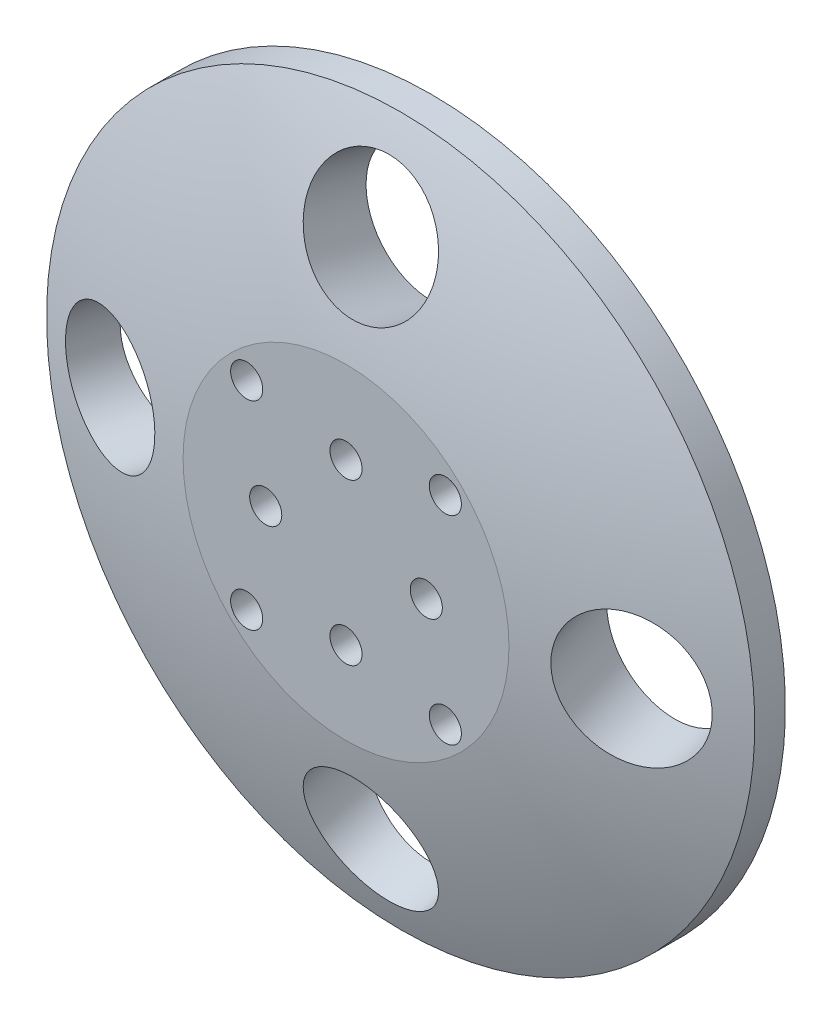
from build123d import *

# Parameters (mm, degrees)
PATTERN_CIRCULAR_1_COUNT = 4
SKETCH_3_R               = 1.6
CUT_EXTRUDE_1_DEPTH      = 10
MOVE_BODY_4_ANGLE        = 90


with BuildPart() as part:
    # 草图1 → 旋转1 (revolve)
    with BuildSketch(Plane(origin=(0, 0, 0), x_dir=(0, 0, -1), z_dir=(1, 0, 0)), mode=Mode.PRIVATE) as revolve_1_sk:
        with BuildLine():
            Line((35.2879411, -15.710089558), (0, -15.710089558))
            Line((0, -15.710089558), (0, -7.210089558))
            Line((0, -7.210089558), (16.237996189, -7.210089558))
            ThreePointArc((16.237996189, -7.210089558), (25.906639592, -9.432422882), (35.2879411, -12.6592809))
            Line((35.2879411, -12.6592809), (35.2879411, -15.710089558))
        make_face()
    revolve(revolve_1_sk.sketch.rotate(Axis((0, 31.276946121, 0), (0, -1, 0)), 180), axis=Axis((0, 31.276946121, 0), (0, -1, 0)))

    # 草图2 → 切除-旋转1 (revolve, cut)
    with BuildSketch(Plane(origin=(0, 0, 0), x_dir=(0, 0, -1), z_dir=(1, 0, 0)), mode=Mode.PRIVATE) as cut_revolve_1_sk:
        Polygon((30.059364586, 4.546712214), (36.307565609, 2.755069401), (21.502083986, -48.87778106), (15.253882963, -47.086138247), align=None)
    cut_revolve_1 = revolve(cut_revolve_1_sk.sketch.rotate(Axis((0, -100.021482202, -0.07491734), (0, 0.9612616959383208, -0.27563735581699245)), 33.246351954), axis=Axis((0, -100.021482202, -0.07491734), (0, 0.9612616959383208, -0.27563735581699245)), mode=Mode.SUBTRACT)

    # 阵列(圆周)1: 切除-旋转1 ×4 about axis
    pattern_circular_1_axis = Axis((0, -7.210089558, 0), (0, 1, 0))
    for i in range(1, PATTERN_CIRCULAR_1_COUNT):
        add(cut_revolve_1.rotate(pattern_circular_1_axis, i * 360 / PATTERN_CIRCULAR_1_COUNT), mode=Mode.SUBTRACT)

    # 草图3 → 切除-拉伸1 (cut)
    with BuildSketch(Plane.XZ.offset(15.710089558)):
        with Locations(Location((8, 0, 0), (0, 0, 270))):
            Circle(SKETCH_3_R)
        with Locations(Location((0, 8, 0), (0, 0, 270))):
            Circle(SKETCH_3_R)
        with Locations(Location((0, -8, 0), (0, 0, 270))):
            Circle(SKETCH_3_R)
        with Locations(Location((-8, 0, 0), (0, 0, 270))):
            Circle(SKETCH_3_R)
        with Locations(Location((9.899494937, -9.899494937, 0), (0, 0, 270))):
            Circle(SKETCH_3_R)
        with Locations(Location((-9.899494937, -9.899494937, 0), (0, 0, 270))):
            Circle(SKETCH_3_R)
        with Locations(Location((-9.899494937, 9.899494937, 0), (0, 0, 270))):
            Circle(SKETCH_3_R)
        with Locations(Location((9.899494937, 9.899494937, 0), (0, 0, 270))):
            Circle(SKETCH_3_R)
    extrude(amount=-CUT_EXTRUDE_1_DEPTH, mode=Mode.SUBTRACT)


with BuildPart() as part_1:
    # Move Body 4: moved
    add(part.part.rotate(Axis((0, -11.460089558, 0), (1, 0, 0)), MOVE_BODY_4_ANGLE))


solid = part_1.part
